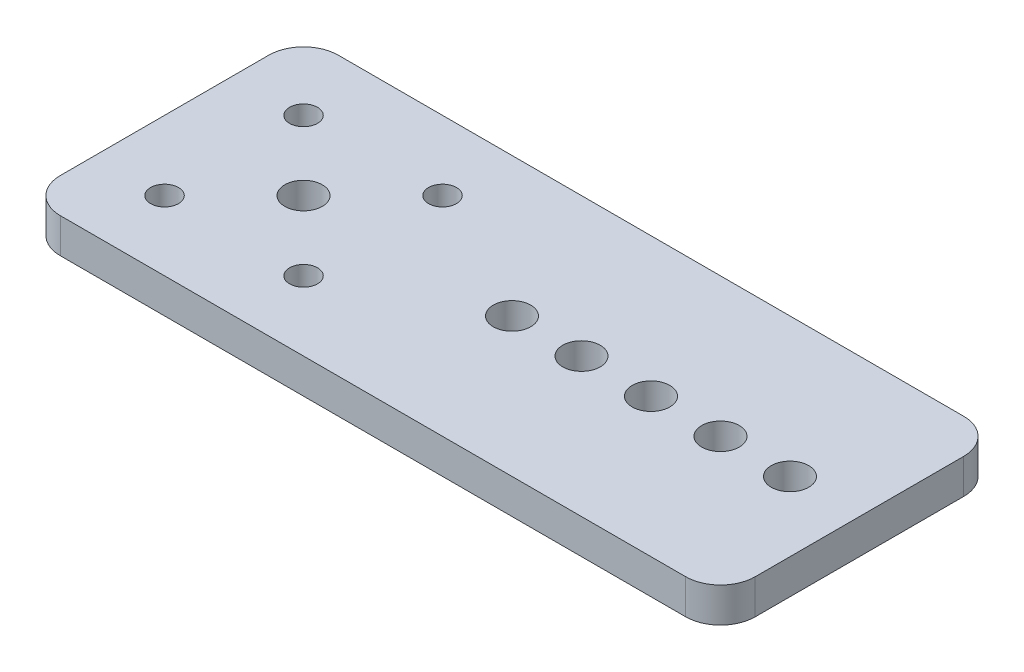
from build123d import *

# Parameters (mm, degrees)
SKETCH1_W           = 127
SKETCH1_H           = 50.8
SKETCH1_R           = 2.5527
SKETCH1_R_2         = 3.429
BOSS_EXTRUDE1_DEPTH = 6.35
FILLET1_R           = 6.35


with BuildPart() as part:
    # Sketch1 → Boss-Extrude1 (new body)
    with BuildSketch(Plane(origin=(0, 0, 0), x_dir=(1, 0, 0), z_dir=(0, 1, 0))):
        with Locations((63.5, -25.4)):
            Rectangle(SKETCH1_W, SKETCH1_H)
        with Locations(Location((12.7, -12.7, 0), (0, 0, 270))):
            Circle(SKETCH1_R, mode=Mode.SUBTRACT)
        with Locations(Location((38.1, -12.7, 0), (0, 0, 270))):
            Circle(SKETCH1_R, mode=Mode.SUBTRACT)
        with Locations(Location((38.1, -38.1, 0), (0, 0, 270))):
            Circle(SKETCH1_R, mode=Mode.SUBTRACT)
        with Locations(Location((12.7, -38.1, 0), (0, 0, 270))):
            Circle(SKETCH1_R, mode=Mode.SUBTRACT)
        with Locations(Location((25.4, -25.4, 0), (0, 0, 270))):
            Circle(SKETCH1_R_2, mode=Mode.SUBTRACT)
        with Locations(Location((63.5, -25.4, 0), (0, 0, 270))):
            Circle(SKETCH1_R_2, mode=Mode.SUBTRACT)
        with Locations(Location((76.2, -25.4, 0), (0, 0, 270))):
            Circle(SKETCH1_R_2, mode=Mode.SUBTRACT)
        with Locations(Location((88.9, -25.4, 0), (0, 0, 270))):
            Circle(SKETCH1_R_2, mode=Mode.SUBTRACT)
        with Locations(Location((101.6, -25.4, 0), (0, 0, 270))):
            Circle(SKETCH1_R_2, mode=Mode.SUBTRACT)
        with Locations(Location((114.3, -25.4, 0), (0, 0, 270))):
            Circle(SKETCH1_R_2, mode=Mode.SUBTRACT)
    extrude(amount=BOSS_EXTRUDE1_DEPTH)

    # Fillet1
    fillet1_edges = [part.edges().sort_by_distance(p)[0] for p in [
        (0, 3.175, 0),
        (127, 3.175, 0),
        (127, 3.175, 50.8),
        (0, 3.175, 50.8),
    ]]
    fillet(fillet1_edges, radius=FILLET1_R)


solid = part.part
